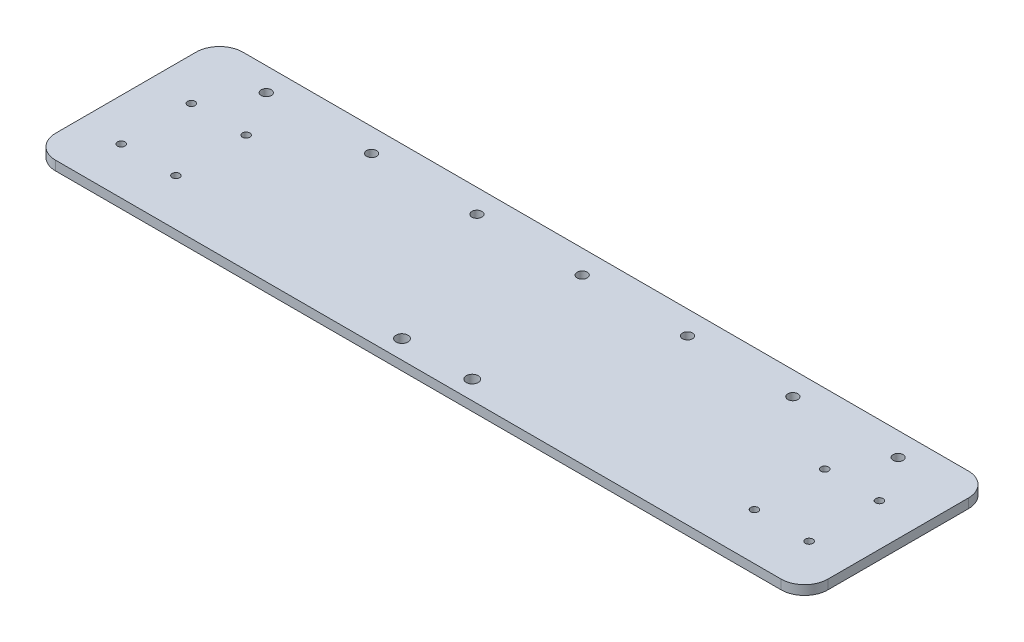
from build123d import *

# Parameters (mm, degrees)
SKETCH_2_W                 = 330
SKETCH_2_H                 = 80
SKETCH_2_R                 = 2.55
EXTRUDE_1_DEPTH            = 4
SKETCH_3_R                 = 1.6
CUT_EXTRUDE_1_DEPTH        = 170.826381932
SKETCH_4_R                 = 2.15
CUT_EXTRUDE_2_DEPTH        = 170.826381932
PATTERN_LINEAR_1_COUNT     = 4
PATTERN_LINEAR_1_PITCH     = 45
PATTERN_LINEAR_1_COL_COUNT = 4
PATTERN_LINEAR_1_COL_PITCH = 45
FILLET_1_R                 = 10


with BuildPart() as part:
    # 草图2 → 凸台-拉伸1 (new body)
    with BuildSketch(Plane(origin=(0, 0, 0), x_dir=(1, 0, 0), z_dir=(0, 1, 0))):
        Rectangle(SKETCH_2_W, SKETCH_2_H)
        with Locations(Location((-15, -32, 0), (0, 0, 270))):
            Circle(SKETCH_2_R, mode=Mode.SUBTRACT)
        with Locations(Location((15, -32, 0), (0, 0, 270))):
            Circle(SKETCH_2_R, mode=Mode.SUBTRACT)
    extrude(amount=EXTRUDE_1_DEPTH)

    # 草图3 → 切除-拉伸1 (cut, through all)
    with BuildSketch(Plane(origin=(0, 0, 0), x_dir=(1, 0, 0), z_dir=(0, 1, 0))):
        with Locations(Location((-147, 10, 0), (0, 0, 270))):
            Circle(SKETCH_3_R)
        with Locations(Location((-147, -20, 0), (0, 0, 270))):
            Circle(SKETCH_3_R)
        with Locations(Location((-123.6, -20, 0), (0, 0, 270))):
            Circle(SKETCH_3_R)
        with Locations(Location((-123.6, 10, 0), (0, 0, 270))):
            Circle(SKETCH_3_R)
    cut_extrude_1 = extrude(amount=CUT_EXTRUDE_1_DEPTH, mode=Mode.SUBTRACT)

    # 镜向1: 切除-拉伸1 across plane
    add(cut_extrude_1.mirror(Plane(origin=(0, 0, 0), x_dir=(0, 0, 1), z_dir=(1, 0, 0))), mode=Mode.SUBTRACT)

    # 草图4 → 切除-拉伸2 (cut, through all)
    with BuildSketch(Plane(origin=(0, 0, 0), x_dir=(1, 0, 0), z_dir=(0, 1, 0))):
        with Locations(Location((0, 30, 0), (0, 0, 270))):
            Circle(SKETCH_4_R)
    cut_extrude_2 = extrude(amount=CUT_EXTRUDE_2_DEPTH, mode=Mode.SUBTRACT)

    # 阵列(线性)1: 切除-拉伸2 ×4
    with Locations(*[(i * PATTERN_LINEAR_1_PITCH, 0, 0) for i in range(1, PATTERN_LINEAR_1_COUNT)]):
        add(cut_extrude_2, mode=Mode.SUBTRACT)

    # 阵列(线性)1 col: 切除-拉伸2 ×4
    with Locations(*[(-i * PATTERN_LINEAR_1_COL_PITCH, 0, 0) for i in range(1, PATTERN_LINEAR_1_COL_COUNT)]):
        add(cut_extrude_2, mode=Mode.SUBTRACT)

    # 圆角1
    fillet_1_edges = [part.edges().sort_by_distance(p)[0] for p in [
        (-165, 2, 40),
        (-165, 2, -40),
        (165, 2, -40),
        (165, 2, 40),
    ]]
    fillet(fillet_1_edges, radius=FILLET_1_R)


solid = part.part
